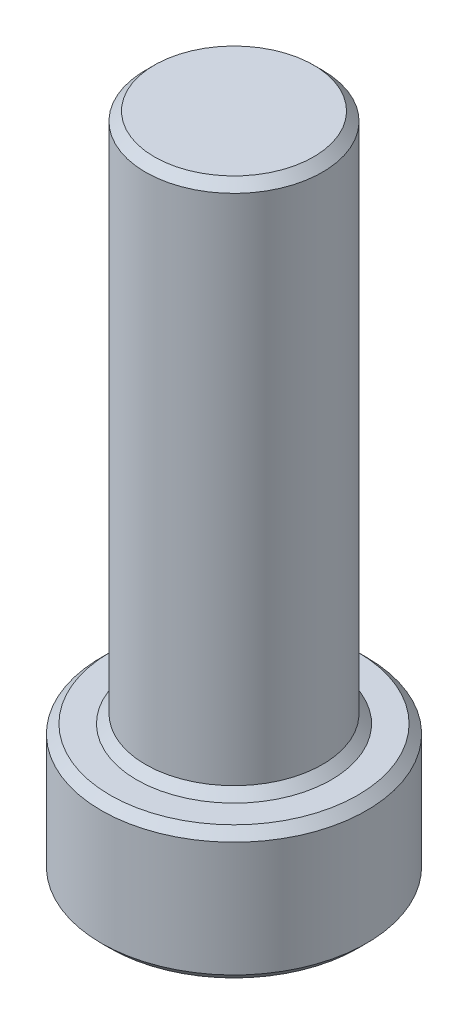
from build123d import *

# Parameters (mm, degrees)
ESQUISSE1_R             = 3
BOSS_EXTRU_1_DEPTH      = 3
ESQUISSE2_R             = 2
BOSS_EXTRU_2_DEPTH      = 12
ESQUISSE3_R             = 1.65
ENL_V_MAT_EXTRU_1_DEPTH = 2
CHANFREIN1_SIZE         = 0.2


with BuildPart() as part:
    # Esquisse1 → Boss.-Extru.1 (new body)
    with BuildSketch(Plane(origin=(0, 0, 0), x_dir=(1, 0, 0), z_dir=(0, 1, 0))):
        with Locations(Location((0, 0, 0), (0, 0, 270))):
            Circle(ESQUISSE1_R)
    extrude(amount=BOSS_EXTRU_1_DEPTH)

    # Esquisse2 → Boss.-Extru.2 (add)
    with BuildSketch(Plane(origin=(0, 3, 0), x_dir=(1, 0, 0), z_dir=(0, 1, 0))):
        with Locations(Location((0, 0, 0), (0, 0, 270))):
            Circle(ESQUISSE2_R)
    extrude(amount=BOSS_EXTRU_2_DEPTH)

    # Esquisse3 → Enlèv. mat.-Extru.1 (cut)
    with BuildSketch(Plane.XZ):
        with Locations(Location((0, 0, 0), (0, 0, 270))):
            Circle(ESQUISSE3_R)
    extrude(amount=-ENL_V_MAT_EXTRU_1_DEPTH, mode=Mode.SUBTRACT)

    # Chanfrein1
    chanfrein1_edges = [part.edges().sort_by_distance(p)[0] for p in [
        (0, 0, 1.65),
        (0, 0, -3),
        (0, 3, -3),
        (0, 3, -2),
        (0, 15, -2),
    ]]
    chamfer(chanfrein1_edges, length=CHANFREIN1_SIZE)


solid = part.part
